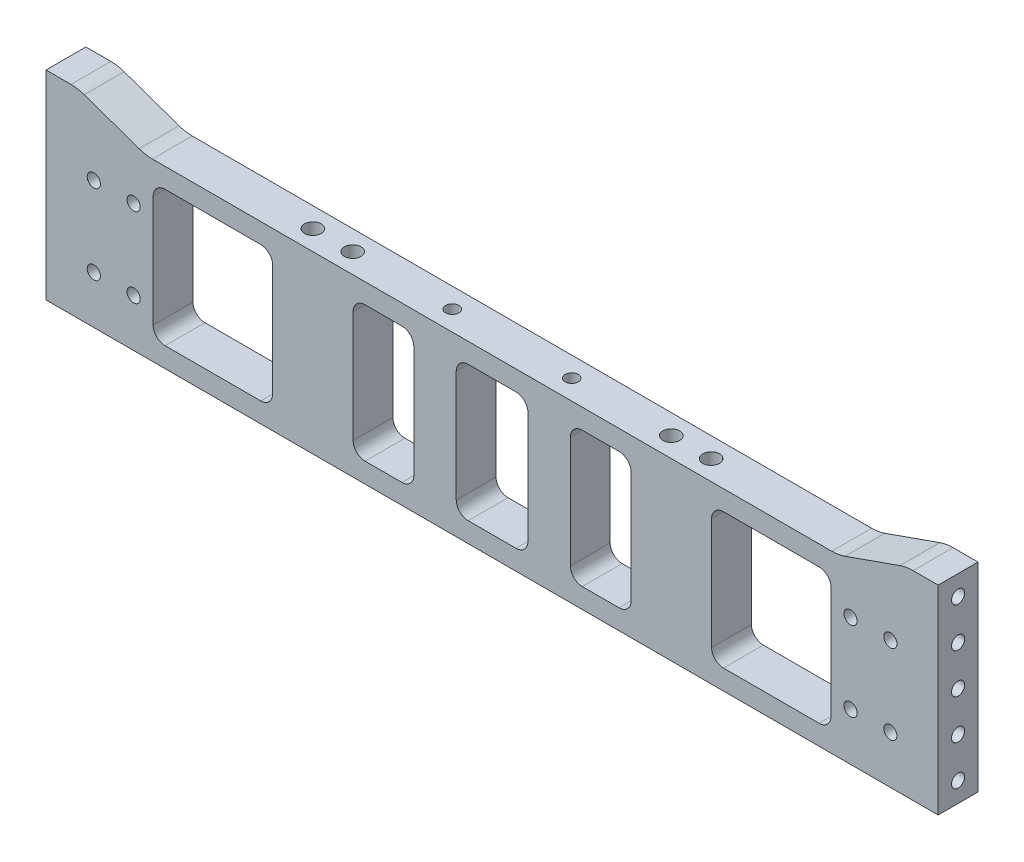
from build123d import *

# Parameters (mm, degrees)
SKETCH_1_W          = 224
SKETCH_1_H          = 44
EXTRUDE_1_DEPTH     = 10
SKETCH_2_R          = 2.1
SKETCH_2_R_2        = 1.65
CUT_EXTRUDE_1_DEPTH = 121.747670785
EXTRUDE_2_DEPTH     = 10
SKETCH_5_R          = 1.65
CUT_EXTRUDE_2_DEPTH = 10
SKETCH_6_R          = 1.65
CUT_EXTRUDE_3_DEPTH = 116.879247495
FILLET_1_R          = 10
SKETCH_7_W          = 18
SKETCH_7_H          = 34
SKETCH_7_W_2        = 15.25
SKETCH_7_W_3        = 30
CUT_EXTRUDE_4_DEPTH = 116.879247495
FILLET_2_R          = 3


with BuildPart() as part:
    # 草图1 → 凸台-拉伸1 (new body)
    with BuildSketch(Plane.XY):
        Rectangle(SKETCH_1_W, SKETCH_1_H)
    extrude(amount=EXTRUDE_1_DEPTH)

    # 草图2 → 切除-拉伸1 (cut, through all)
    with BuildSketch(Plane(origin=(0, 22, 0), x_dir=(1, 0, 0), z_dir=(0, 1, 0))):
        with Locations(Location((-40, -5, 0), (0, 0, 180))):
            Circle(SKETCH_2_R)
        with Locations(Location((-50, -5, 0), (0, 0, 180))):
            Circle(SKETCH_2_R)
        with Locations((50, -5)):
            Circle(SKETCH_2_R)
        with Locations((40, -5)):
            Circle(SKETCH_2_R)
        with Locations(Location((-15, -5, 0), (0, 0, 180))):
            Circle(SKETCH_2_R_2)
        with Locations((15, -5)):
            Circle(SKETCH_2_R_2)
    extrude(amount=-CUT_EXTRUDE_1_DEPTH, mode=Mode.SUBTRACT)

    # 草图4 → 凸台-拉伸2 (add)
    with BuildSketch(Plane.XY.offset(10)):
        Polygon((112, 22), (112, 28), (104, 28), (87, 22), align=None)
        Polygon((-87, 22), (-112, 22), (-112, 28), (-104, 28), align=None)
    extrude(amount=-EXTRUDE_2_DEPTH)

    # 草图5 → 切除-拉伸2 (cut)
    with BuildSketch(Plane(origin=(112, 0, 0), x_dir=(0, 0, -1), z_dir=(1, 0, 0))):
        with Locations((-5, 23)):
            Circle(SKETCH_5_R)
        with Locations((-5, 13)):
            Circle(SKETCH_5_R)
        with Locations((-5, 3)):
            Circle(SKETCH_5_R)
        with Locations((-5, -7)):
            Circle(SKETCH_5_R)
        with Locations((-5, -17)):
            Circle(SKETCH_5_R)
    cut_extrude_2 = extrude(amount=-CUT_EXTRUDE_2_DEPTH, mode=Mode.SUBTRACT)

    # 镜向1: 切除-拉伸2 across plane
    add(cut_extrude_2.mirror(Plane(origin=(0, 0, 0), x_dir=(0, 0, 1), z_dir=(1, 0, 0))), mode=Mode.SUBTRACT)

    # 草图6 → 切除-拉伸3 (cut, through all)
    with BuildSketch(Plane.XY.offset(10)):
        with Locations((-100, 10)):
            Circle(SKETCH_6_R)
        with Locations((-100, -10)):
            Circle(SKETCH_6_R)
        with Locations(Location((100, -10, 0), (0, 0, 180))):
            Circle(SKETCH_6_R)
        with Locations(Location((100, 10, 0), (0, 0, 180))):
            Circle(SKETCH_6_R)
        with Locations((-90, 10)):
            Circle(SKETCH_6_R)
        with Locations((-90, -10)):
            Circle(SKETCH_6_R)
        with Locations(Location((90, -10, 0), (0, 0, 180))):
            Circle(SKETCH_6_R)
        with Locations(Location((90, 10, 0), (0, 0, 180))):
            Circle(SKETCH_6_R)
    extrude(amount=-CUT_EXTRUDE_3_DEPTH, mode=Mode.SUBTRACT)

    # 圆角1
    fillet_1_edges = [part.edges().sort_by_distance(p)[0] for p in [
        (87, 22, 5),
        (104, 28, 5),
        (-104, 28, 5),
        (-87, 22, 5),
    ]]
    fillet(fillet_1_edges, radius=FILLET_1_R)

    # 草图7 → 切除-拉伸4 (cut, through all)
    with BuildSketch(Plane.XY.offset(10)):
        Rectangle(SKETCH_7_W, SKETCH_7_H)
        with Locations((27.275, 0)):
            Rectangle(SKETCH_7_W_2, SKETCH_7_H)
        with Locations((70.1, 0)):
            Rectangle(SKETCH_7_W_3, SKETCH_7_H)
        with Locations((-70.1, 0)):
            Rectangle(SKETCH_7_W_3, SKETCH_7_H)
        with Locations((-27.275, 0)):
            Rectangle(SKETCH_7_W_2, SKETCH_7_H)
    extrude(amount=-CUT_EXTRUDE_4_DEPTH, mode=Mode.SUBTRACT)

    # 圆角2
    fillet_2_edges = [part.edges().sort_by_distance(p)[0] for p in [
        (-19.65, 17, 5),
        (-19.65, -17, 5),
        (-34.9, -17, 5),
        (-34.9, 17, 5),
        (-85.1, -17, 5),
        (-85.1, 17, 5),
        (-55.1, 17, 5),
        (-55.1, -17, 5),
        (55.1, -17, 5),
        (55.1, 17, 5),
        (85.1, 17, 5),
        (85.1, -17, 5),
        (34.9, 17, 5),
        (34.9, -17, 5),
        (19.65, -17, 5),
        (19.65, 17, 5),
        (9, 17, 5),
        (9, -17, 5),
        (-9, -17, 5),
        (-9, 17, 5),
    ]]
    fillet(fillet_2_edges, radius=FILLET_2_R)


solid = part.part
